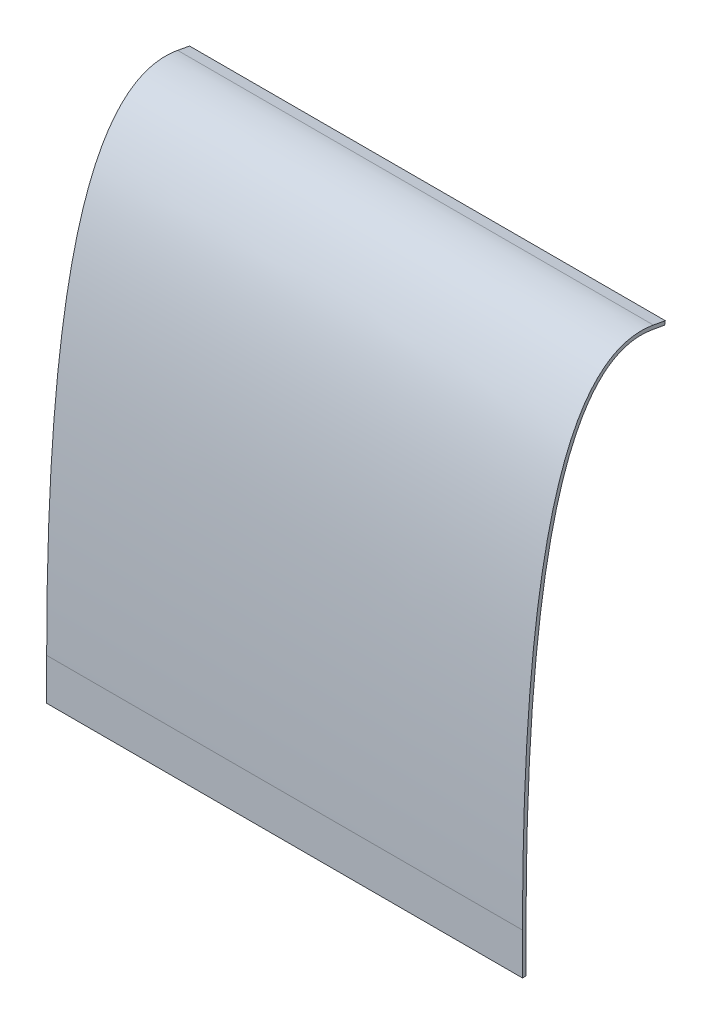
from build123d import *

# Parameters (mm, degrees)
SKETCH1_W           = 418.07892
SKETCH1_H           = 36.484920899
BOSS_EXTRUDE1_DEPTH = 3.175


with BuildPart() as part:
    # Sketch1 → Boss-Extrude1 (new body)
    with BuildSketch(Plane.XY):
        with Locations((209.03946, -5371.611347536)):
            Rectangle(SKETCH1_W, SKETCH1_H)
    extrude(amount=BOSS_EXTRUDE1_DEPTH)

    # Sweep1: sweep along a curve in space
    with BuildLine() as sweep1_path:
        Line((418.07892, -5353.368887086, 0), (0, -5353.368887086, 0))
    # Sketch7 → Sweep1 (sweep)
    with BuildSketch(Plane.ZY):
        with BuildLine():
            Line((-111.330615302, -4953.621170417), (-121.798132423, -4955.538736641))
            Line((-121.798132423, -4955.538736641), (-122.370246605, -4952.415707604))
            Line((-122.370246605, -4952.415707604), (-111.902729484, -4950.498141381))
            add(Edge.make_bspline(
                [(3.175, -5353.368887087), (3.175, -5351.187396909), (3.170465411, -5346.811431343), (3.143256962, -5338.163410177), (3.075233484, -5327.47644189), (2.939178486, -5314.871463464), (2.685193541, -5298.349309679), (2.231609699, -5278.23364404), (1.469474893, -5254.952708203), (0.489420195, -5232.529689243), (-1.108022954, -5203.775714934), (-3.650209462, -5169.976331388), (-7.574872597, -5132.842689158), (-12.375948375, -5099.130221292), (-18.056948382, -5068.832930711), (-26.814336297, -5032.97936704), (-37.360530821, -5003.918669037), (-49.795766977, -4981.598907346), (-60.121348091, -4968.227399974), (-71.513011288, -4958.258769675), (-81.923670653, -4952.880902224), (-90.753377806, -4950.406618489), (-97.597956352, -4949.47166616), (-103.474595102, -4949.459506517), (-108.25392015, -4949.901598406), (-110.696774931, -4950.277220059), (-111.902729484, -4950.498141381)],
                knots=[0.490445447, 0.490445447, 0.490445447, 0.490445447, 0.490528714, 0.490611981, 0.490778515, 0.490945049, 0.491111583, 0.491444651, 0.49177772, 0.492110788, 0.492443856, 0.493109992, 0.493776128, 0.494442265, 0.495108401, 0.495774537, 0.49710681, 0.497772946, 0.498439083, 0.499105219, 0.499771355, 0.500104423, 0.500437491, 0.50077056, 0.500937094, 0.501103628, 0.501103628, 0.501103628, 0.501103628], degree=3))
            Line((3.175, -5353.368887087), (0, -5353.368887086))
            add(Edge.make_bspline(
                [(0, -5353.368887086), (0, -4933.226283541), (-111.330615302, -4953.621170417)],
                knots=[0, 0, 0, 1, 1, 1], degree=2))
        make_face()
    sweep(path=sweep1_path.line)


solid = part.part
